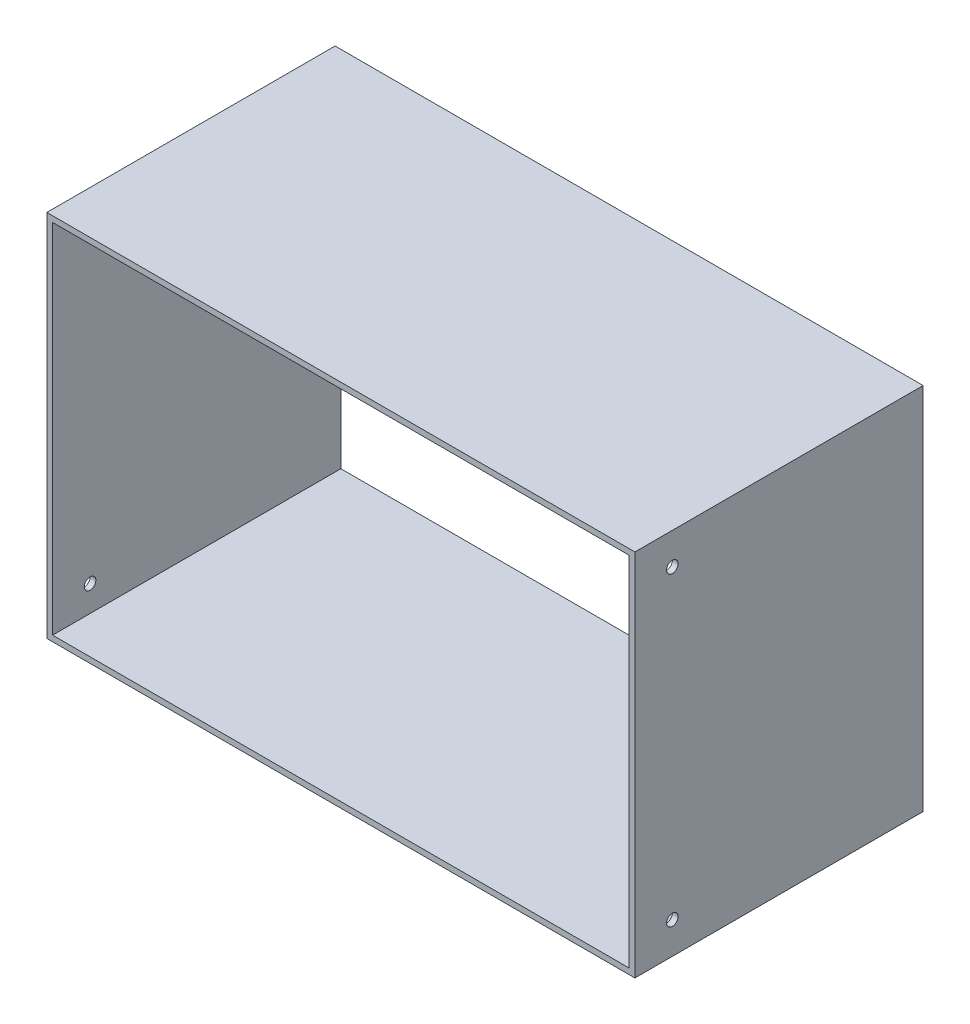
from build123d import *

# Parameters (mm, degrees)
SKETCH_1_W               = 102
SKETCH_1_H               = 64
SKETCH_1_W_2             = 100
SKETCH_1_H_2             = 62
EXTRUDE_1_DEPTH          = 50
CUT_EXTRUDE_2_DEPTH      = 102
CUT_EXTRUDE_2_DEPTH_BACK = 1
SKETCH_5_R               = 1


with BuildPart() as part:
    # Эскиз1 → Бобышка-Вытянуть1 (new body)
    with BuildSketch(Plane.XY):
        with Locations((53, 34)):
            Rectangle(SKETCH_1_W, SKETCH_1_H)
        with Locations((53, 34)):
            Rectangle(SKETCH_1_W_2, SKETCH_1_H_2, mode=Mode.SUBTRACT)
    extrude(amount=EXTRUDE_1_DEPTH)

    # Эскиз5 → Вырез-Вытянуть2 (cut, two sides: drawn at the far end of the back side and taken through both)
    with BuildSketch(Plane.ZY.offset(-103).offset(-CUT_EXTRUDE_2_DEPTH_BACK)):
        with Locations((43.5, 7.5)):
            Circle(SKETCH_5_R)
        with Locations((43.5, 60.5)):
            Circle(SKETCH_5_R)
    extrude(amount=CUT_EXTRUDE_2_DEPTH + CUT_EXTRUDE_2_DEPTH_BACK, mode=Mode.SUBTRACT)


solid = part.part
